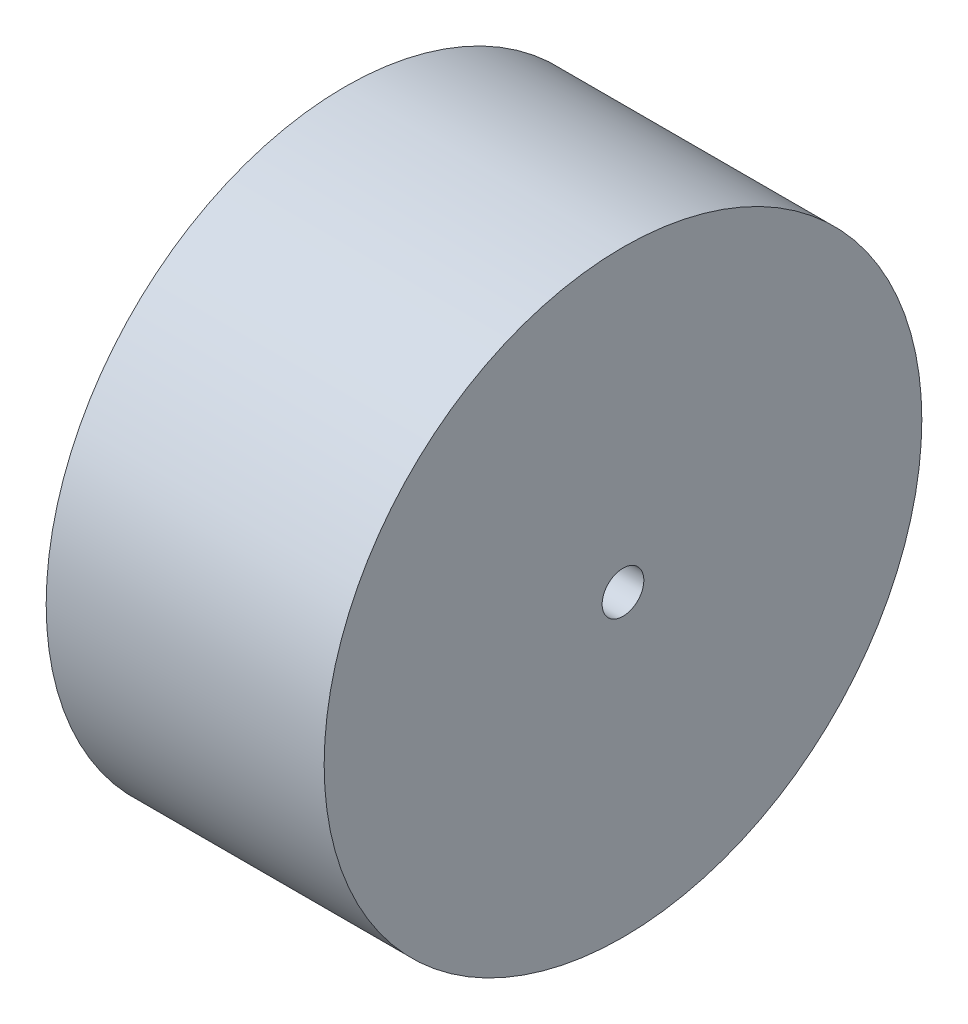
from build123d import *

# Parameters (mm, degrees)
CROQUIS1_R              = 21.5
SALIENTE_EXTRUIR1_DEPTH = 20
CROQUIS2_R              = 1.5
CORTAR_EXTRUIR1_DEPTH   = 30


with BuildPart() as part:
    # Croquis1 → Saliente-Extruir1 (new body)
    with BuildSketch(Plane(origin=(0, 0, 0), x_dir=(0, 0, -1), z_dir=(1, 0, 0))):
        Circle(CROQUIS1_R)
    extrude(amount=SALIENTE_EXTRUIR1_DEPTH)

    # Croquis2 → Cortar-Extruir1 (cut)
    with BuildSketch(Plane(origin=(20, 0, 0), x_dir=(0, 0, -1), z_dir=(1, 0, 0))):
        Circle(CROQUIS2_R)
    extrude(amount=-CORTAR_EXTRUIR1_DEPTH, mode=Mode.SUBTRACT)


solid = part.part
